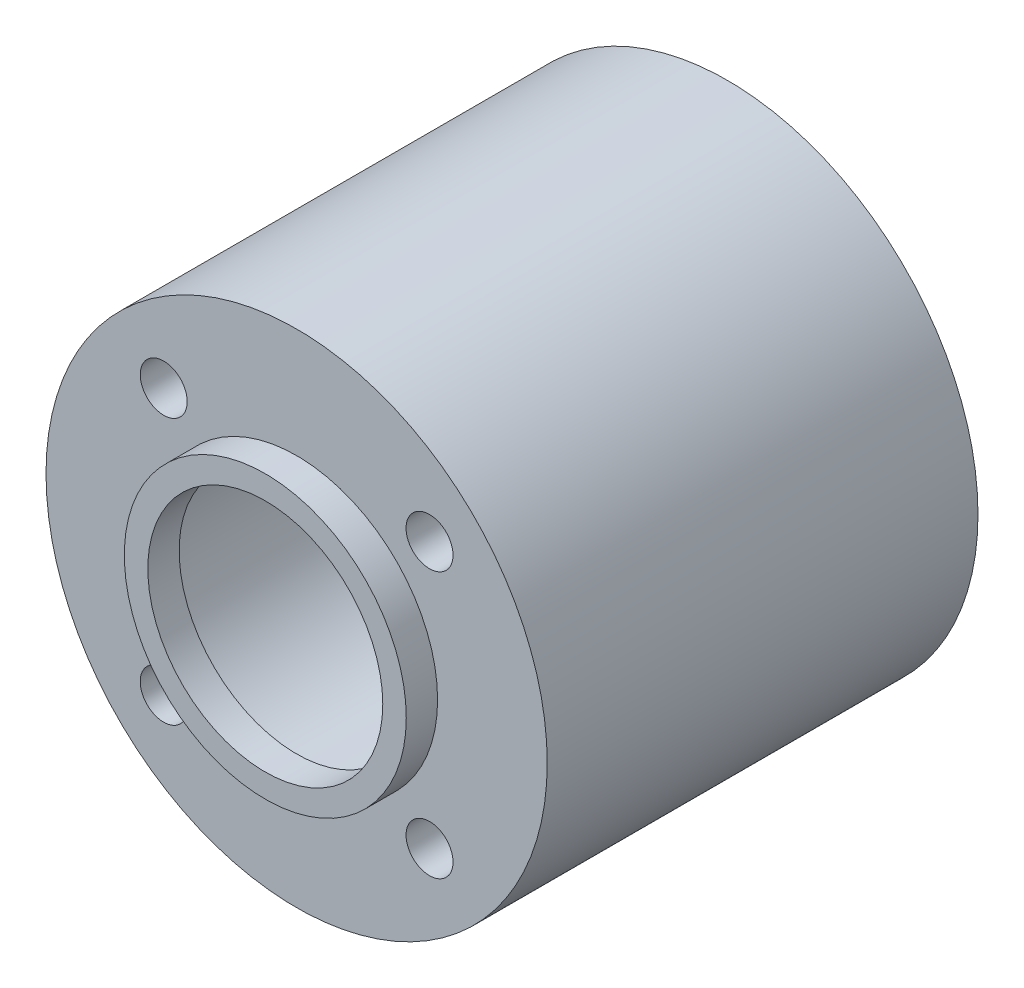
from build123d import *

# Parameters (mm, degrees)
SKETCH1_R           = 16
SKETCH1_R_2         = 1.5
SKETCH1_R_3         = 9
BOSS_EXTRUDE1_DEPTH = 27.5
SKETCH1_3_R         = 9
SKETCH1_3_R_2       = 7.5
BOSS_EXTRUDE2_DEPTH = 2


with BuildPart() as part:
    # Sketch1 → Boss-Extrude1 (new body)
    with BuildSketch(Plane.XY):
        Circle(SKETCH1_R)
        with Locations((-8.485281374, -8.485281374)):
            Circle(SKETCH1_R_2, mode=Mode.SUBTRACT)
        with Locations((8.485281374, -8.485281374)):
            Circle(SKETCH1_R_2, mode=Mode.SUBTRACT)
        with Locations((-8.485281374, 8.485281374)):
            Circle(SKETCH1_R_2, mode=Mode.SUBTRACT)
        Circle(SKETCH1_R_3, mode=Mode.SUBTRACT)
        with Locations((8.485281374, 8.485281374)):
            Circle(SKETCH1_R_2, mode=Mode.SUBTRACT)
    extrude(amount=-BOSS_EXTRUDE1_DEPTH)


with BuildPart() as body_2:
    # Sketch1<3> → Boss-Extrude2 (new body)
    with BuildSketch(Plane.XY):
        Circle(SKETCH1_3_R)
        Circle(SKETCH1_3_R_2, mode=Mode.SUBTRACT)
    extrude(amount=BOSS_EXTRUDE2_DEPTH)


solid = Compound([part.part, body_2.part])
